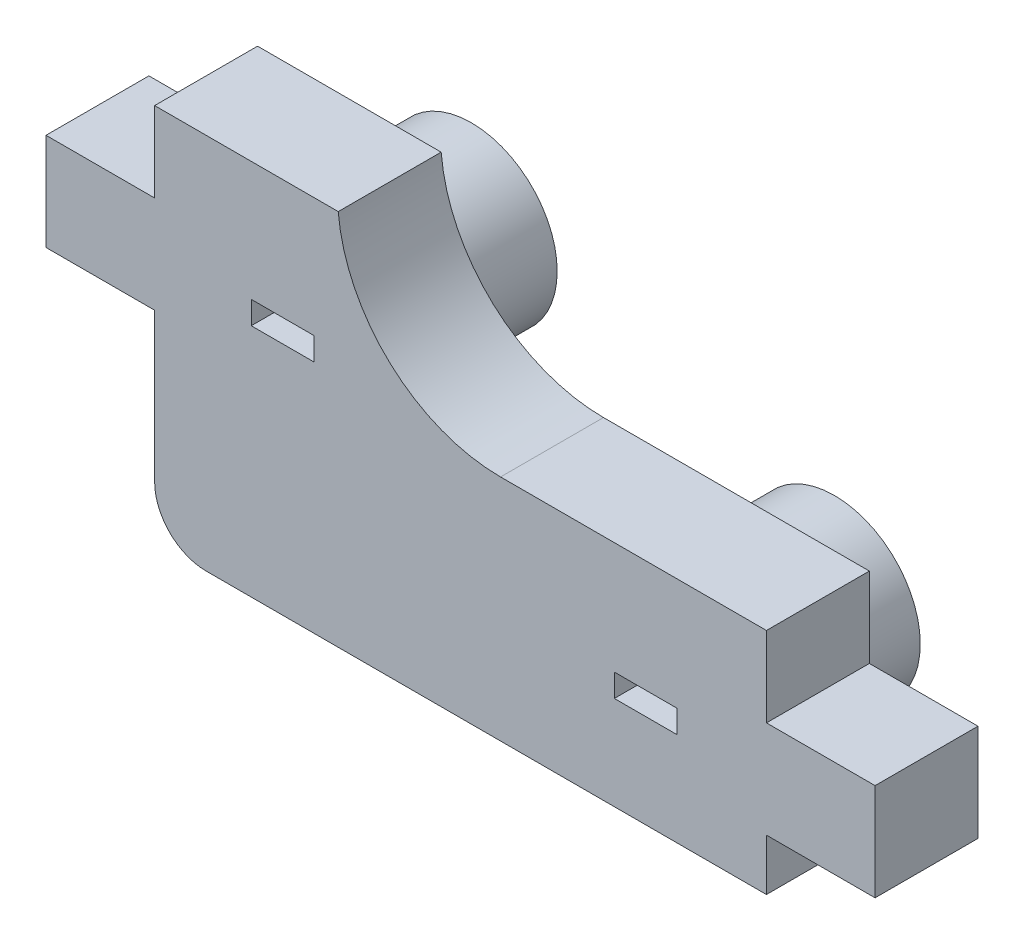
from build123d import *

# Parameters (mm, degrees)
EXTRUDE_1_DEPTH     = 1.8
SKETCH_2_R          = 1.5
EXTRUDE_2_DEPTH     = 1.5
SKETCH_2_3_W        = 1.1
SKETCH_2_3_H        = 0.4
CUT_EXTRUDE_1_DEPTH = 11.647300127


with BuildPart() as part:
    # 草图1 → 凸台-拉伸1 (new body)
    with BuildSketch(Plane.XY):
        with BuildLine():
            Line((-2.839013913, -0.25), (-6.05, -0.25))
            Line((-6.05, -0.25), (-6.05, -1.65))
            Line((-6.05, -1.65), (-7.95, -1.65))
            Line((-7.95, -1.65), (-7.95, -3.35))
            Line((-7.95, -3.35), (-6.05, -3.35))
            Line((-6.05, -3.35), (-6.05, -5.95))
            ThreePointArc((-6.05, -5.95), (-5.786396103, -6.586396103), (-5.15, -6.85))
            Line((-5.15, -6.85), (4.65, -6.85))
            Line((4.65, -6.85), (4.65, -5.95))
            Line((4.65, -5.95), (6.55, -5.95))
            Line((6.55, -5.95), (6.55, -4.25))
            Line((6.55, -4.25), (4.65, -4.25))
            Line((4.65, -4.25), (4.65, -2.85))
            Line((4.65, -2.85), (0, -2.85))
            ThreePointArc((0, -2.85), (-1.924837655, -2.101784956), (-2.839013913, -0.25))
        make_face()
    extrude(amount=EXTRUDE_1_DEPTH)

    # 草图2 → 凸台-拉伸2 (add)
    with BuildSketch(Plane(origin=(0, 0, 0), x_dir=(-1, 0, 0), z_dir=(0, 0, -1))):
        with Locations((-2.54, -5.01)):
            Circle(SKETCH_2_R)
        with Locations((3.81, -2.54)):
            Circle(SKETCH_2_R)
    extrude(amount=EXTRUDE_2_DEPTH)

    # 草图2<3> → 切除-拉伸1 (cut, through all)
    with BuildSketch(Plane(origin=(0, 0, 0), x_dir=(-1, 0, 0), z_dir=(0, 0, -1))):
        with Locations((-2.54, -5.01)):
            Rectangle(SKETCH_2_3_W, SKETCH_2_3_H)
        with Locations((3.81, -2.54)):
            Rectangle(SKETCH_2_3_W, SKETCH_2_3_H)
    extrude(amount=-CUT_EXTRUDE_1_DEPTH, mode=Mode.SUBTRACT)


solid = part.part
